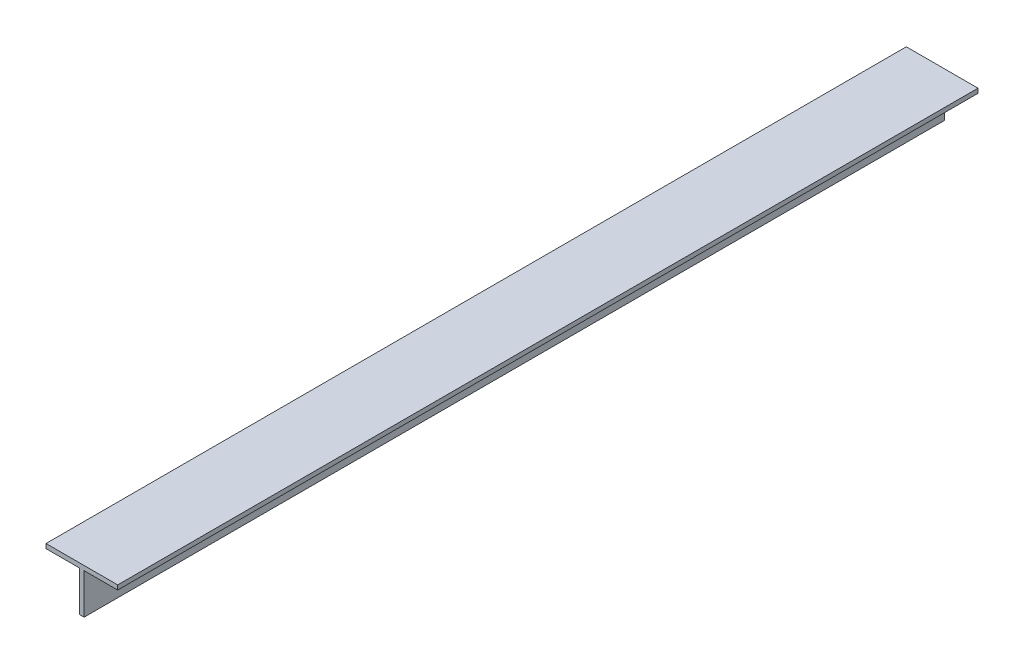
from build123d import *

# Parameters (mm, degrees)
BOSS_EXTRUDE1_DEPTH = 304.8
SKETCH2_R           = 3.5
CUT_EXTRUDE1_DEPTH  = 308.635218491


with BuildPart() as part:
    # Sketch1 → Boss-Extrude1 (new, symmetric)
    with BuildSketch(Plane.XY):
        Polygon((-25.4, 31.75), (-25.4, 28.575), (-1.5875, 28.575), (-1.5875, 0), (1.5875, 0), (1.5875, 28.575), (25.4, 28.575), (25.4, 31.75), align=None)
    extrude(amount=BOSS_EXTRUDE1_DEPTH, both=True)

    # Sketch2 → Cut-Extrude1 (cut, through all)
    with BuildSketch(Plane(origin=(1.5875, 0, 0), x_dir=(0, 0, -1), z_dir=(1, 0, 0))):
        with Locations(Location((-200, 15.875, 0), (0, 0, 90))):
            Circle(SKETCH2_R)
        with Locations(Location((200, 15.875, 0), (0, 0, 90))):
            Circle(SKETCH2_R)
    extrude(amount=-CUT_EXTRUDE1_DEPTH, mode=Mode.SUBTRACT)


solid = part.part
